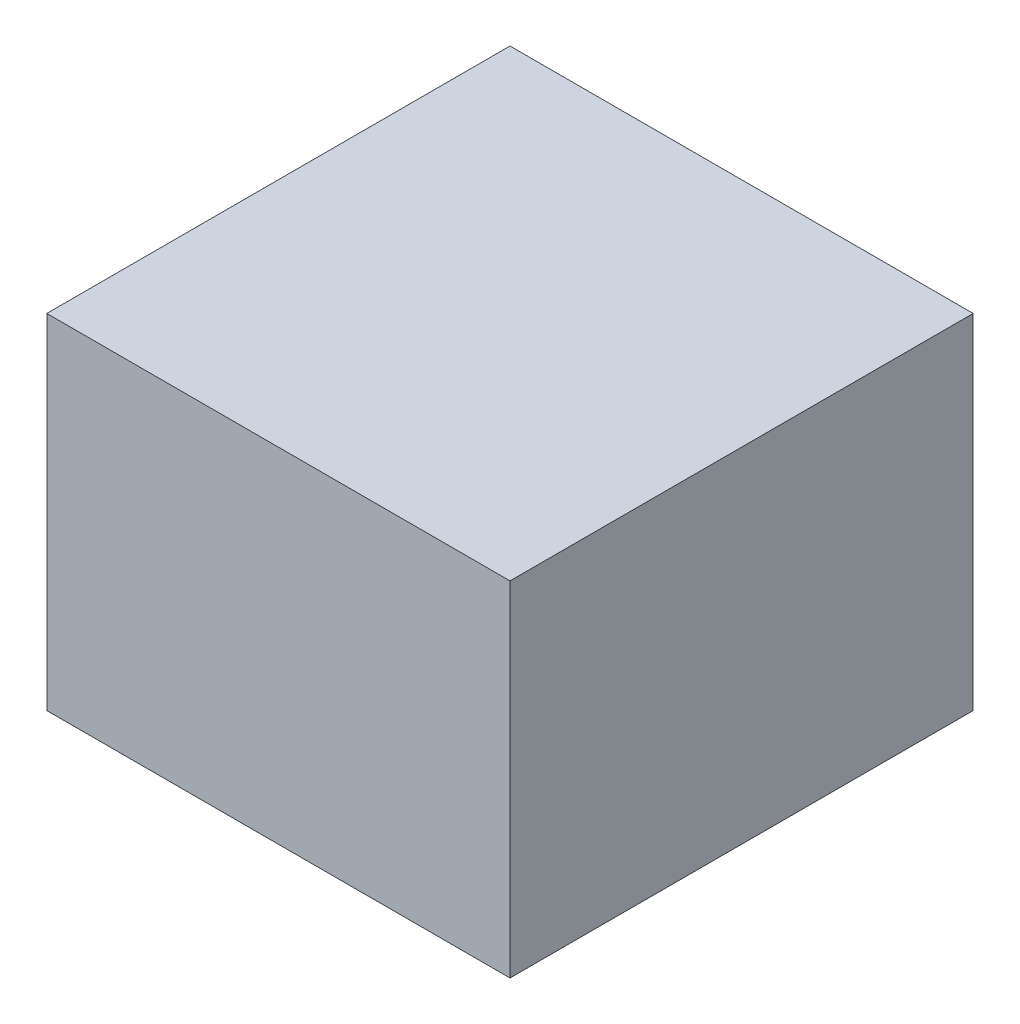
from build123d import *

# Parameters (mm, degrees)
SKETCH1_W           = 591.82
SKETCH1_H           = 591.82
BOSS_EXTRUDE1_DEPTH = 439.42


with BuildPart() as part:
    # Sketch1 → Boss-Extrude1 (new body)
    with BuildSketch(Plane(origin=(0, 0, 0), x_dir=(1, 0, 0), z_dir=(0, 1, 0))):
        with Locations((-76.772619647, -17.888765743)):
            Rectangle(SKETCH1_W, SKETCH1_H)
    extrude(amount=BOSS_EXTRUDE1_DEPTH)


solid = part.part
